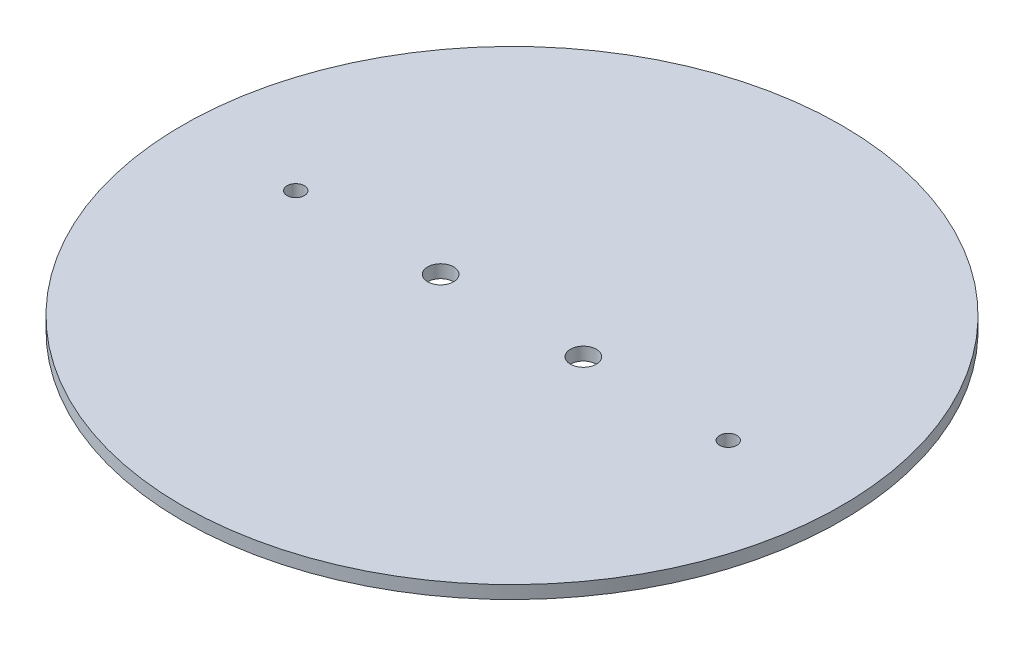
from build123d import *

# Parameters (mm, degrees)
BOSS_EXTRUDE1_DEPTH      = 1.5
BOSS_EXTRUDE1_DEPTH_BACK = 1.5
SKETCH1_R                = 76.2
SKETCH1_R_2              = 2
SKETCH1_R_3              = 3


with BuildPart() as part:
    # Sketch1 → Boss-Extrude1 (new, two sides: drawn at the far end of the back side and taken through both)
    with BuildSketch(Plane(origin=(0, 0, 0), x_dir=(1, 0, 0), z_dir=(0, 1, 0)).offset(-BOSS_EXTRUDE1_DEPTH_BACK)):
        Circle(SKETCH1_R)
        with Locations((-50, 0)):
            Circle(SKETCH1_R_2, mode=Mode.SUBTRACT)
        with Locations((50, 0)):
            Circle(SKETCH1_R_2, mode=Mode.SUBTRACT)
        with Locations((-16.5, 0)):
            Circle(SKETCH1_R_3, mode=Mode.SUBTRACT)
        with Locations((16.5, 0)):
            Circle(SKETCH1_R_3, mode=Mode.SUBTRACT)
    extrude(amount=BOSS_EXTRUDE1_DEPTH + BOSS_EXTRUDE1_DEPTH_BACK)


solid = part.part
